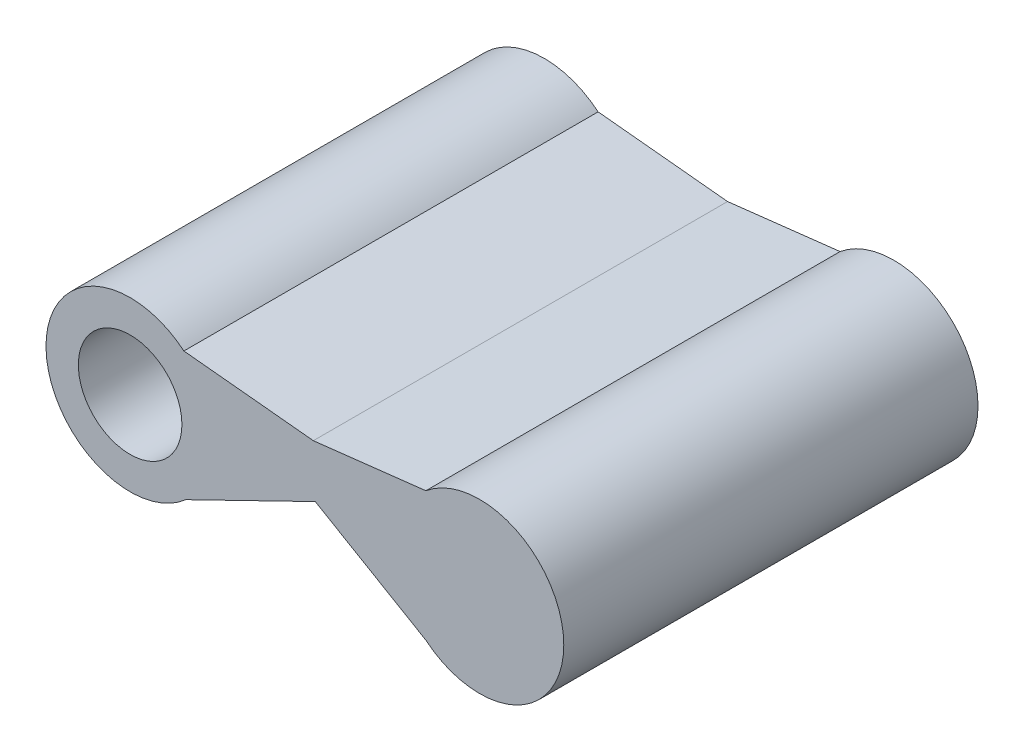
from build123d import *

# Parameters (mm, degrees)
SKETCH1_R           = 2
BOSS_EXTRUDE1_DEPTH = 16


with BuildPart() as part:
    # Sketch1 → Boss-Extrude1 (new body)
    with BuildSketch(Plane.XY):
        with BuildLine():
            Line((2.076655966, 2.5), (7.076655966, 2))
            Line((7.076655966, 2), (11.423344034, 2.5))
            ThreePointArc((11.423344034, 2.5), (16.75, 0), (11.423344034, -2.5))
            Line((11.423344034, -2.5), (7.151636088, 0))
            Line((7.151636088, 0), (2.151636088, -2.43576726))
            ThreePointArc((2.151636088, -2.43576726), (-3.249625061, -0.049365635), (2.076655966, 2.5))
        make_face()
        Circle(SKETCH1_R, mode=Mode.SUBTRACT)
    extrude(amount=BOSS_EXTRUDE1_DEPTH)


solid = part.part
